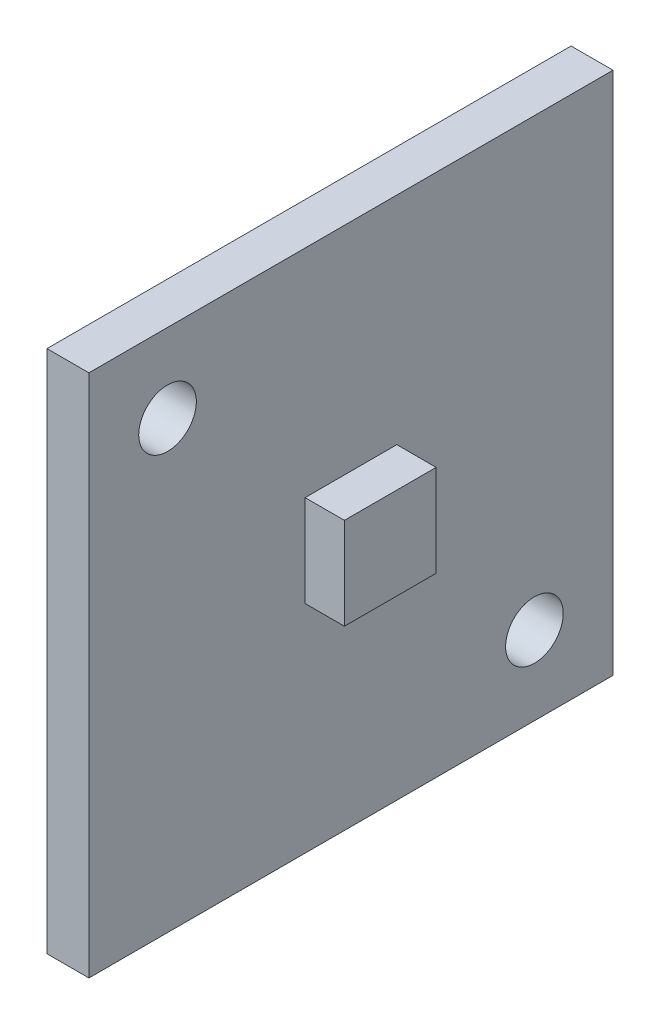
from build123d import *

# Parameters (mm, degrees)
SKETCH1_W           = 20
SKETCH1_H           = 20
BOARD_DEPTH         = 1.6
SKETCH2_W           = 3.5
SKETCH2_H           = 3.5
UV_LED_3535_DEPTH   = 1.5
HOLES_M2_DEPTH      = 15.2323575
HOLES_M2_DEPTH_BACK = 15.2323575
SKETCH3_R           = 1.1


with BuildPart() as part:
    # Sketch1 → Board (new body)
    with BuildSketch(Plane(origin=(0, 0, 0), x_dir=(0, 0, -1), z_dir=(1, 0, 0))):
        Rectangle(SKETCH1_W, SKETCH1_H)
    extrude(amount=-BOARD_DEPTH)

    # Sketch2 → UV_LED_3535 (add)
    with BuildSketch(Plane(origin=(0, 0, 0), x_dir=(0, 0, -1), z_dir=(1, 0, 0))):
        Rectangle(SKETCH2_W, SKETCH2_H)
    extrude(amount=UV_LED_3535_DEPTH)

    # Sketch3 → Holes_M2 (cut, two sides: drawn at the far end of the back side and taken through both)
    with BuildSketch(Plane(origin=(0, 0, 0), x_dir=(0, 0, -1), z_dir=(1, 0, 0)).offset(-HOLES_M2_DEPTH_BACK)):
        with Locations(Location((7, -7, 0), (0, 0, 180))):
            Circle(SKETCH3_R)
        with Locations(Location((-7, 7, 0), (0, 0, 180))):
            Circle(SKETCH3_R)
    extrude(amount=HOLES_M2_DEPTH + HOLES_M2_DEPTH_BACK, mode=Mode.SUBTRACT)


solid = part.part
